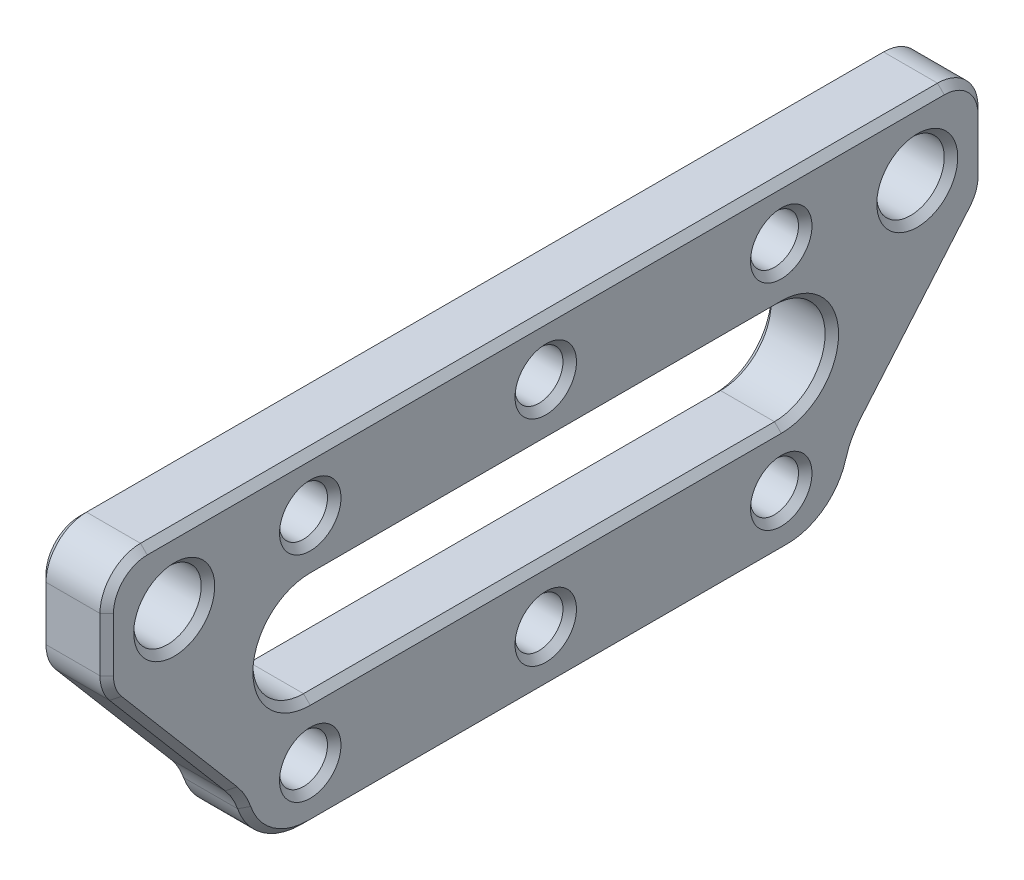
from build123d import *

# Parameters (mm, degrees)
SKETCH1_W                = 24
SKETCH1_H                = 65.06
BOSS_EXTRUDE1_DEPTH      = 5
CUT_EXTRUDE1_DEPTH       = 100.109842599
CUT_EXTRUDE2_DEPTH       = 100.109842599
CUT_EXTRUDE3_DEPTH       = 100.109842599
M3_CLEARANCE_HOLE1_D     = 3.556
M3_CLEARANCE_HOLE2_D     = 3.556
F_5_0_5_DIAMETER_HOLE1_D = 5
F_5_0_5_DIAMETER_HOLE2_D = 5
FILLET1_R                = 3
CHAMFER1_SIZE            = 0.5


with BuildPart() as part:
    # Sketch1 → Boss-Extrude1 (new body)
    with BuildSketch(Plane(origin=(-8.175, 0, 0), x_dir=(0, -1, 0), z_dir=(-1, 0, 0))):
        with Locations((12, -63.5)):
            Rectangle(SKETCH1_W, SKETCH1_H)
    extrude(amount=-BOSS_EXTRUDE1_DEPTH)

    # Sketch2 → Cut-Extrude1 (cut, through all)
    with BuildSketch(Plane(origin=(-3.175, 0, 0), x_dir=(0, 0, -1), z_dir=(1, 0, 0))):
        with BuildLine():
            Line((30.97, -24), (45.892842167, -24))
            ThreePointArc((45.892842167, -24), (42.991793175, -23.072335294), (41.167224487, -20.633565899))
            ThreePointArc((41.167224487, -20.633565899), (40.784453665, -19.789293795), (40.252408967, -19.030190819))
            Line((40.252408967, -19.030190819), (30.97, -8.102149698))
            Line((30.97, -8.102149698), (30.97, -24))
        make_face()
    extrude(amount=-CUT_EXTRUDE1_DEPTH, mode=Mode.SUBTRACT)

    # Sketch3 → Cut-Extrude2 (cut, through all)
    with BuildSketch(Plane(origin=(-3.175, 0, 0), x_dir=(0, 0, -1), z_dir=(1, 0, 0))):
        with BuildLine():
            Line((81.4047462, -24), (96.03, -24))
            Line((96.03, -24), (96.03, -8.102149698))
            Line((96.03, -8.102149698), (87.219197841, -18.474975184))
            ThreePointArc((87.219197841, -18.474975184), (86.616905128, -19.361470748), (86.2173731, -20.355958082))
            ThreePointArc((86.2173731, -20.355958082), (84.423041214, -22.986213141), (81.4047462, -24))
        make_face()
    extrude(amount=-CUT_EXTRUDE2_DEPTH, mode=Mode.SUBTRACT)

    # Sketch4 → Cut-Extrude3 (cut, through all)
    with BuildSketch(Plane(origin=(-3.175, 0, 0), x_dir=(0, 0, -1), z_dir=(1, 0, 0))):
        with BuildLine():
            Line((80.95, -8.1875), (46.05, -8.1875))
            ThreePointArc((46.05, -8.1875), (42.3, -11.9375), (46.05, -15.6875))
            Line((46.05, -15.6875), (80.95, -15.6875))
            ThreePointArc((80.95, -15.6875), (84.7, -11.9375), (80.95, -8.1875))
        make_face()
    extrude(amount=-CUT_EXTRUDE3_DEPTH, mode=Mode.SUBTRACT)

    # M3 Clearance Hole1 (through all)
    with Locations(Plane.ZY.offset(8.175)):
        with Locations((-46.05, -4)):
            Hole(M3_CLEARANCE_HOLE1_D / 2)

    # M3 Clearance Hole2 (through all)
    with Locations(Plane(origin=(-3.175, 0, 0), x_dir=(0, 0, -1), z_dir=(1, 0, 0))):
        with Locations((46.05, -19.875), (63.5, -19.875), (80.95, -19.875), (80.95, -4), (63.5, -4)):
            Hole(M3_CLEARANCE_HOLE2_D / 2)

    # Ø5.0 (5) Diameter Hole1 (through all)
    with Locations(Plane.ZY.offset(8.175)):
        with Locations((-91.03, -5)):
            Hole(F_5_0_5_DIAMETER_HOLE1_D / 2)

    # Ø5.0 (5) Diameter Hole2 (through all)
    with Locations(Plane(origin=(-3.175, 0, 0), x_dir=(0, 0, -1), z_dir=(1, 0, 0))):
        with Locations((35.97, -5)):
            Hole(F_5_0_5_DIAMETER_HOLE2_D / 2)

    # Fillet1
    fillet1_edges = [part.edges().sort_by_distance(p)[0] for p in [
        (-5.675, -8.102149698, -30.97),
        (-5.675, -8.102149698, -96.03),
        (-5.675, 0, -96.03),
        (-5.675, 0, -30.97),
    ]]
    fillet(fillet1_edges, radius=FILLET1_R)

    # Chamfer1
    chamfer1_edges = [part.edges().sort_by_distance(p)[0] for p in [
        (-8.175, -5, -88.53),
        (-3.175, -5, -88.53),
        (-3.175, -5, -38.47),
        (-8.175, -5, -38.47),
        (-8.175, -5, -30.97),
        (-3.175, -5, -30.97),
        (-3.175, -13.708569886, -91.267839568),
        (-3.175, -5, -96.03),
        (-3.175, 0, -63.5),
        (-3.175, -8.034542438, -95.845976197),
        (-3.175, -0.878679656, -31.848679656),
        (-3.175, -0.878679656, -95.151320344),
        (-3.175, -8.034542438, -31.154023803),
        (-8.175, -5, -96.03),
        (-8.175, -13.708569886, -91.267839568),
        (-8.175, 0, -63.5),
        (-8.175, -8.034542438, -95.845976197),
        (-8.175, -0.878679656, -31.848679656),
        (-8.175, -0.878679656, -95.151320344),
        (-8.175, -8.034542438, -31.154023803),
        (-8.175, -13.986177703, -35.967963836),
        (-8.175, -19.789293795, -40.784453665),
        (-8.175, -23.072335294, -42.991793175),
        (-3.175, -23.072335294, -42.991793175),
        (-3.175, -19.789293795, -40.784453665),
        (-3.175, -13.986177703, -35.967963836),
        (-8.175, -24, -63.648794183),
        (-3.175, -24, -63.648794183),
        (-8.175, -19.361470748, -86.616905128),
        (-8.175, -22.986213141, -84.423041214),
        (-3.175, -19.361470748, -86.616905128),
        (-3.175, -22.986213141, -84.423041214),
        (-8.175, -11.9375, -84.7),
        (-8.175, -15.6875, -63.5),
        (-8.175, -11.9375, -42.3),
        (-8.175, -8.1875, -63.5),
        (-3.175, -11.9375, -84.7),
        (-3.175, -8.1875, -63.5),
        (-3.175, -11.9375, -42.3),
        (-3.175, -15.6875, -63.5),
        (-8.175, -4, -44.272),
        (-3.175, -4, -44.272),
        (-3.175, -4, -65.278),
        (-8.175, -4, -65.278),
        (-3.175, -4, -82.728),
        (-8.175, -4, -82.728),
        (-3.175, -19.875, -82.728),
        (-8.175, -19.875, -82.728),
        (-3.175, -19.875, -65.278),
        (-8.175, -19.875, -65.278),
        (-3.175, -19.875, -47.828),
        (-8.175, -19.875, -47.828),
    ]]
    chamfer(chamfer1_edges, length=CHAMFER1_SIZE)


solid = part.part
